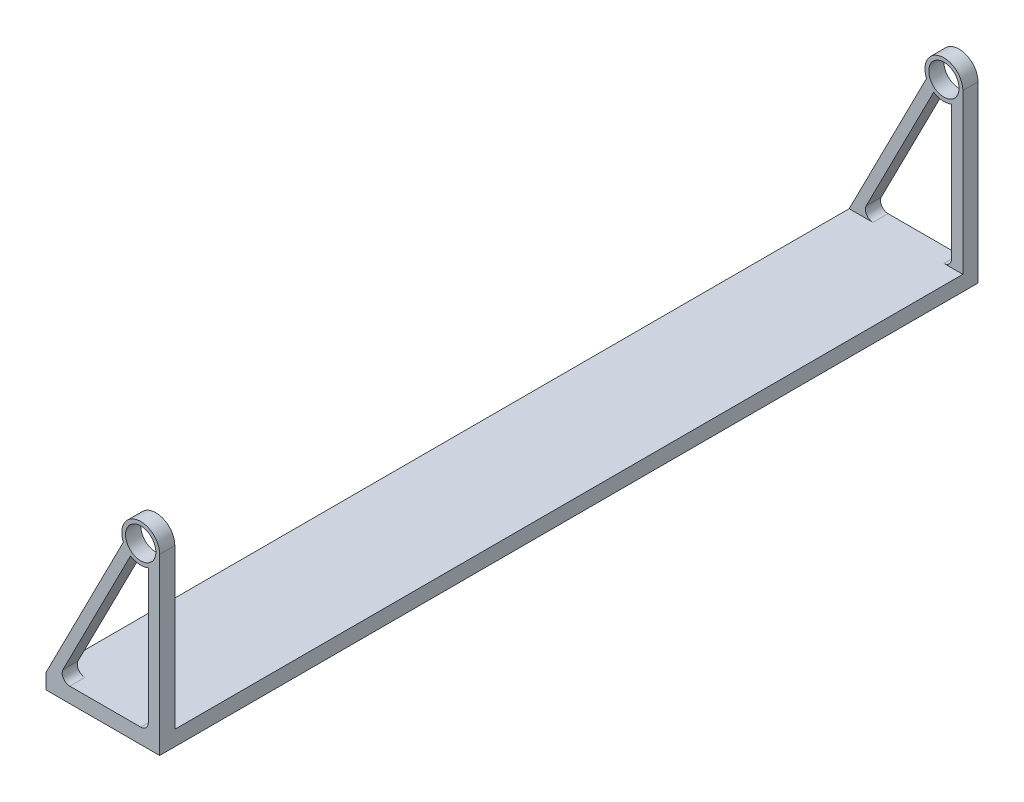
from build123d import *

# Parameters (mm, degrees)
SKETCH1_W           = 381
SKETCH1_H           = 2743.2
BOSS_EXTRUDE1_DEPTH = 50.8
SKETCH2_R           = 63.5
SKETCH2_R_2         = 50.8
BOSS_EXTRUDE2_DEPTH = 50.8
FILLET1_R           = 25.4


with BuildPart() as part:
    # Sketch1 → Boss-Extrude1 (new body)
    with BuildSketch(Plane(origin=(0, 0, 0), x_dir=(1, 0, 0), z_dir=(0, 1, 0))):
        Rectangle(SKETCH1_W, SKETCH1_H)
    extrude(amount=BOSS_EXTRUDE1_DEPTH)

    # Sketch2 → Boss-Extrude2 (add)
    # profile 1 of 3: a face of its own
    with BuildSketch(Plane.XY.offset(1371.6)):
        with BuildLine():
            ThreePointArc((92.766835976, 530.71784895), (78.777173297, 542.88645519), (68.898941042, 558.577413324))
            Line((68.898941042, 558.577413324), (-190.5, 50.8))
            Line((-190.5, 50.8), (-152.4, 50.8))
            Line((-152.4, 50.8), (92.766835976, 530.71784895))
        make_face()
    # profile 2 of 3: a face of its own
    with BuildSketch(Plane.XY.offset(1371.6)):
        with BuildLine():
            Line((152.4, 50.8), (190.5, 50.8))
            Line((190.5, 50.8), (190.5, 584.2))
            ThreePointArc((190.5, 584.2), (180.127911685, 549.419617598), (152.4, 526.001288674))
            Line((152.4, 526.001288674), (152.4, 50.8))
        make_face()
    # profile 3 of 3: a face of its own
    with BuildSketch(Plane.XY.offset(1371.6)):
        with Locations((127, 584.2)):
            Circle(SKETCH2_R)
        with Locations((127, 584.2)):
            Circle(SKETCH2_R_2, mode=Mode.SUBTRACT)
    boss_extrude2 = extrude(amount=-BOSS_EXTRUDE2_DEPTH)

    # Mirror1: Boss-Extrude2 across plane
    add(boss_extrude2.mirror(Plane.XY))

    # Fillet1
    fillet1_edges = [part.edges().sort_by_distance(p)[0] for p in [
        (-152.4, 50.8, 1346.2),
        (152.4, 50.8, 1346.2),
        (-152.4, 50.8, -1346.2),
        (152.4, 50.8, -1346.2),
    ]]
    fillet(fillet1_edges, radius=FILLET1_R)


solid = part.part
